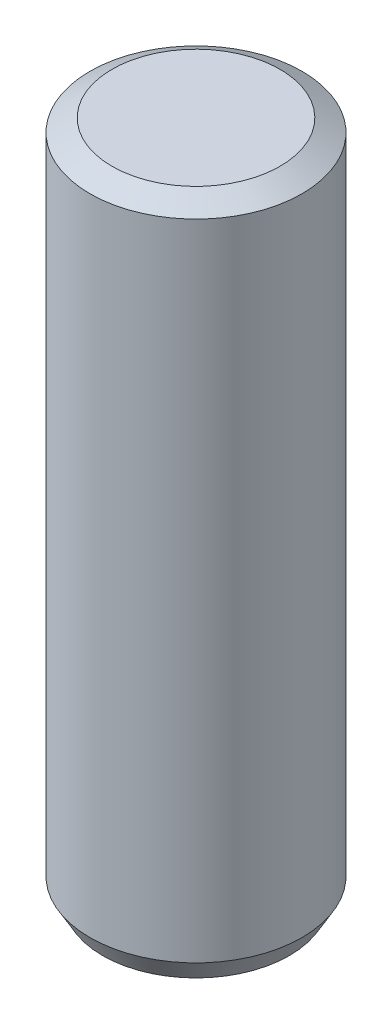
from build123d import *
from OCP.BRepFilletAPI import BRepFilletAPI_MakeChamfer

# Parameters (mm, degrees)
SKETCH1_R           = 2.5
BOSS_EXTRUDE1_DEPTH = 16
CHAMFER1_SIZE       = 0.3
CHAMFER1_SIZE2      = 0.519615242


with BuildPart() as part:
    # Sketch1 → Boss-Extrude1 (new body)
    with BuildSketch(Plane(origin=(0, 0, 0), x_dir=(1, 0, 0), z_dir=(0, 1, 0))):
        with Locations(Location((0, 0, 0), (0, 0, 270))):
            Circle(SKETCH1_R)
    extrude(amount=BOSS_EXTRUDE1_DEPTH)

    # Chamfer1: one chamfer whose edges measure the first distance from different faces: ONE call of the kernel's chamfer builder (chamfer() names one face for all edges)
    chamfer1_edges_1 = [part.edges().sort_by_distance(p)[0] for p in [
        (0, 0, -2.5),
    ]]
    chamfer1_side_1 = [part.faces().sort_by_distance(p)[0] for p in [
        (0, 0, 0),
    ]]
    chamfer1_edges_2 = [part.edges().sort_by_distance(p)[0] for p in [
        (0, 16, -2.5),
    ]]
    chamfer1_side_2 = [part.faces().sort_by_distance(p)[0] for p in [
        (0, 8, -2.5),
    ]]
    chamfer1 = BRepFilletAPI_MakeChamfer(part.part.solid().wrapped)
    for e in chamfer1_edges_1:
        chamfer1.Add(CHAMFER1_SIZE, CHAMFER1_SIZE2, e.wrapped, chamfer1_side_1[0].wrapped)  # the first distance lies on this face
    for e in chamfer1_edges_2:
        chamfer1.Add(CHAMFER1_SIZE, CHAMFER1_SIZE2, e.wrapped, chamfer1_side_2[0].wrapped)  # the first distance lies on this face
    add(Compound.cast(chamfer1.Shape()), mode=Mode.REPLACE)


solid = part.part
